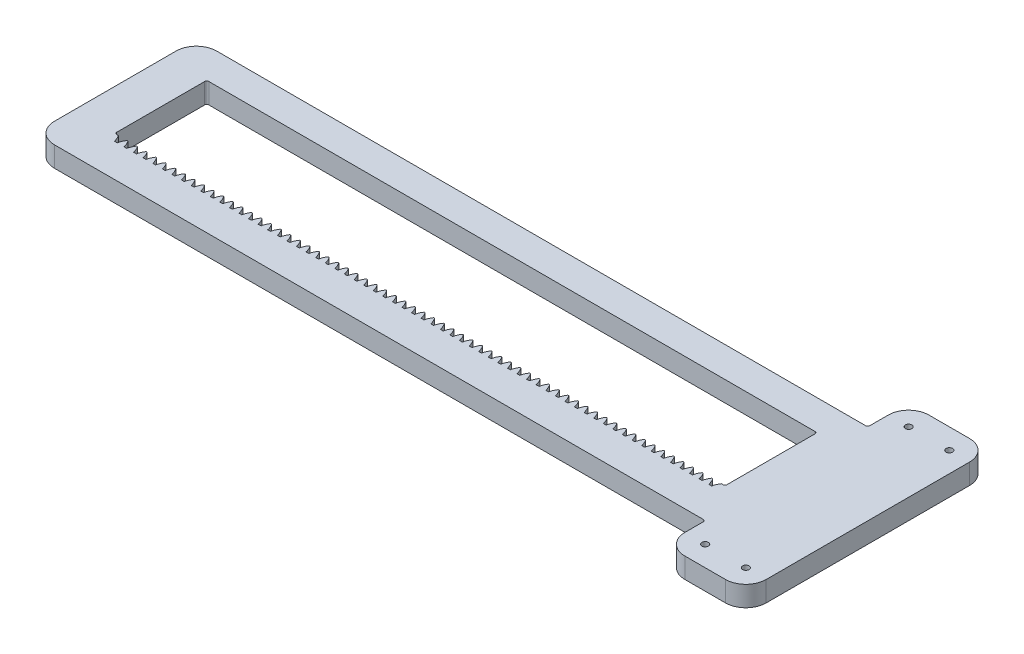
from build123d import *

# Parameters (mm, degrees)
SKETCH1_W               = 300
SKETCH1_H               = 45.25
BOSS_EXTRUDE1_DEPTH     = 5
CUT_EXTRUDE1_DEPTH      = 209.865985742
LPATTERN1_COUNT         = 32
LPATTERN1_PITCH         = 4.71238898
LPATTERN1_COL_COUNT     = 32
LPATTERN1_COL_PITCH     = 4.71238898
FILLET2_R               = 1
CUT_EXTRUDE2_DEPTH      = 210.045449604
CUT_EXTRUDE2_DEPTH_BACK = 210.045449604
SKETCH5_R               = 1.6
FILLET3_R               = 10
FILLET4_R               = 10
FILLET5_R               = 1


with BuildPart() as part:
    # Sketch1 → Boss-Extrude1 (new, symmetric)
    with BuildSketch(Plane(origin=(0, 0, 0), x_dir=(1, 0, 0), z_dir=(0, 1, 0))):
        Polygon((-170, 39.9), (-170, -39.9), (160, -39.9), (160, -60), (200, -60), (200, -39.9), (200, 39.9), (200, 60), (160, 60), (160, 39.9), align=None)
        with Locations((0, 2.375)):
            Rectangle(SKETCH1_W, SKETCH1_H, mode=Mode.SUBTRACT)
    extrude(amount=BOSS_EXTRUDE1_DEPTH, both=True)

    # Sketch3 → Cut-Extrude1 (cut, symmetric)
    with BuildSketch(Plane(origin=(0, 0, 0), x_dir=(1, 0, 0), z_dir=(0, 1, 0))):
        with BuildLine():
            ThreePointArc((0.696879992, -23.638221775), (0, -23.626), (-0.696879992, -23.638221775))
            ThreePointArc((-0.696879992, -23.638221775), (-1.235801231, -21.867044126), (-2.137285929, -20.25))
            ThreePointArc((-2.137285929, -20.25), (0, -20.151970294), (2.137285929, -20.25))
            ThreePointArc((2.137285929, -20.25), (1.235801231, -21.867044126), (0.696879992, -23.638221775))
        make_face()
    cut_extrude1 = extrude(amount=CUT_EXTRUDE1_DEPTH, both=True, mode=Mode.SUBTRACT)

    # LPattern1: Cut-Extrude1 ×32
    with Locations(*[(i * LPATTERN1_PITCH, 0, 0) for i in range(1, LPATTERN1_COUNT)]):
        add(cut_extrude1, mode=Mode.SUBTRACT)

    # LPattern1 col: Cut-Extrude1 ×32
    with Locations(*[(-i * LPATTERN1_COL_PITCH, 0, 0) for i in range(1, LPATTERN1_COL_COUNT)]):
        add(cut_extrude1, mode=Mode.SUBTRACT)

    # Fillet2
    fillet2_edges = [part.edges().sort_by_distance(p)[0] for p in [
        (-150, 0, -25),
        (-150, 0, 20.25),
        (150, 0, 20.25),
        (150, 0, -25),
    ]]
    fillet(fillet2_edges, radius=FILLET2_R)

    # Sketch5 → Cut-Extrude2 (cut, two sides: drawn at the far end of the back side and taken through both)
    with BuildSketch(Plane(origin=(0, 5, 0), x_dir=(1, 0, 0), z_dir=(0, 1, 0)).offset(-CUT_EXTRUDE2_DEPTH_BACK)):
        with Locations(Location((170, 50, 0), (0, 0, 270))):
            Circle(SKETCH5_R)
        with Locations(Location((190, 50, 0), (0, 0, 270))):
            Circle(SKETCH5_R)
        with Locations(Location((190, -50, 0), (0, 0, 270))):
            Circle(SKETCH5_R)
        with Locations(Location((170, -50, 0), (0, 0, 270))):
            Circle(SKETCH5_R)
    extrude(amount=CUT_EXTRUDE2_DEPTH + CUT_EXTRUDE2_DEPTH_BACK, mode=Mode.SUBTRACT)

    # Fillet3
    fillet3_edges = [part.edges().sort_by_distance(p)[0] for p in [
        (200, 0, -60),
        (200, 0, 60),
        (160, 0, 60),
        (160, 0, -60),
    ]]
    fillet(fillet3_edges, radius=FILLET3_R)

    # Fillet4
    fillet4_edges = [part.edges().sort_by_distance(p)[0] for p in [
        (-170, 0, 39.9),
        (-170, 0, -39.9),
    ]]
    fillet(fillet4_edges, radius=FILLET4_R)

    # Fillet5
    fillet5_edges = [part.edges().sort_by_distance(p)[0] for p in [
        (160, 0, 39.9),
        (160, 0, -39.9),
    ]]
    fillet(fillet5_edges, radius=FILLET5_R)


solid = part.part
